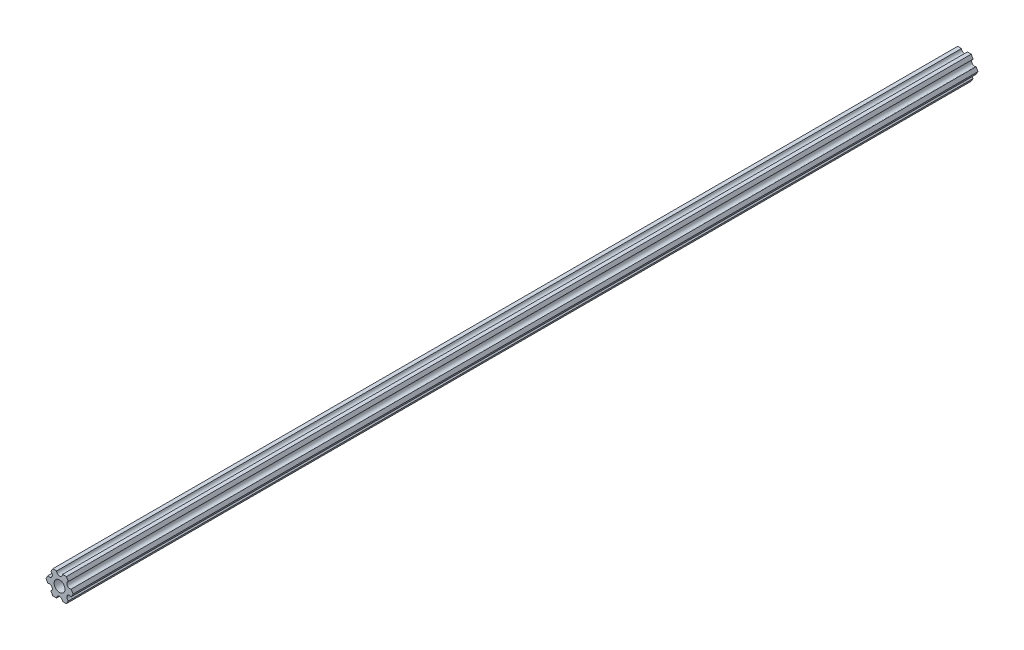
from build123d import *

# Parameters (mm, degrees)
SKETCH1_R           = 2.9337
BOSS_EXTRUDE1_DEPTH = 244.475


with BuildPart() as part:
    # Sketch1 → Boss-Extrude1 (new, symmetric)
    with BuildSketch(Plane.XY):
        with BuildLine():
            Line((-1.587500385, 6.349999904), (-3.666174594, 6.349999778))
            Line((-3.666174594, 6.349999778), (-4.70551159, 4.549815043))
            ThreePointArc((-4.70551159, 4.549815043), (-4.12444613, 2.38124975), (-6.293011423, 1.80018429))
            Line((-6.293011423, 1.80018429), (-7.332348419, -4.44e-07))
            Line((-7.332348419, -4.44e-07), (-6.293011205, -1.800185053))
            ThreePointArc((-6.293011205, -1.800185053), (-4.124445841, -2.38125025), (-4.705511038, -4.549815614))
            Line((-4.705511038, -4.549815614), (-3.666173825, -6.350000222))
            Line((-3.666173825, -6.350000222), (-1.587499615, -6.350000096))
            ThreePointArc((-1.587499615, -6.350000096), (2.89e-07, -4.7625), (1.587500385, -6.349999904))
            Line((1.587500385, -6.349999904), (3.666174594, -6.349999778))
            Line((3.666174594, -6.349999778), (4.70551159, -4.549815043))
            ThreePointArc((4.70551159, -4.549815043), (4.12444613, -2.38124975), (6.293011423, -1.80018429))
            Line((6.293011423, -1.80018429), (7.332348419, 4.44e-07))
            Line((7.332348419, 4.44e-07), (6.293011205, 1.800185053))
            ThreePointArc((6.293011205, 1.800185053), (4.124445841, 2.38125025), (4.705511038, 4.549815614))
            Line((4.705511038, 4.549815614), (3.666173825, 6.350000222))
            Line((3.666173825, 6.350000222), (1.587499615, 6.350000096))
            ThreePointArc((1.587499615, 6.350000096), (-2.89e-07, 4.7625), (-1.587500385, 6.349999904))
        make_face()
        Circle(SKETCH1_R, mode=Mode.SUBTRACT)
    extrude(amount=BOSS_EXTRUDE1_DEPTH, both=True)


solid = part.part
